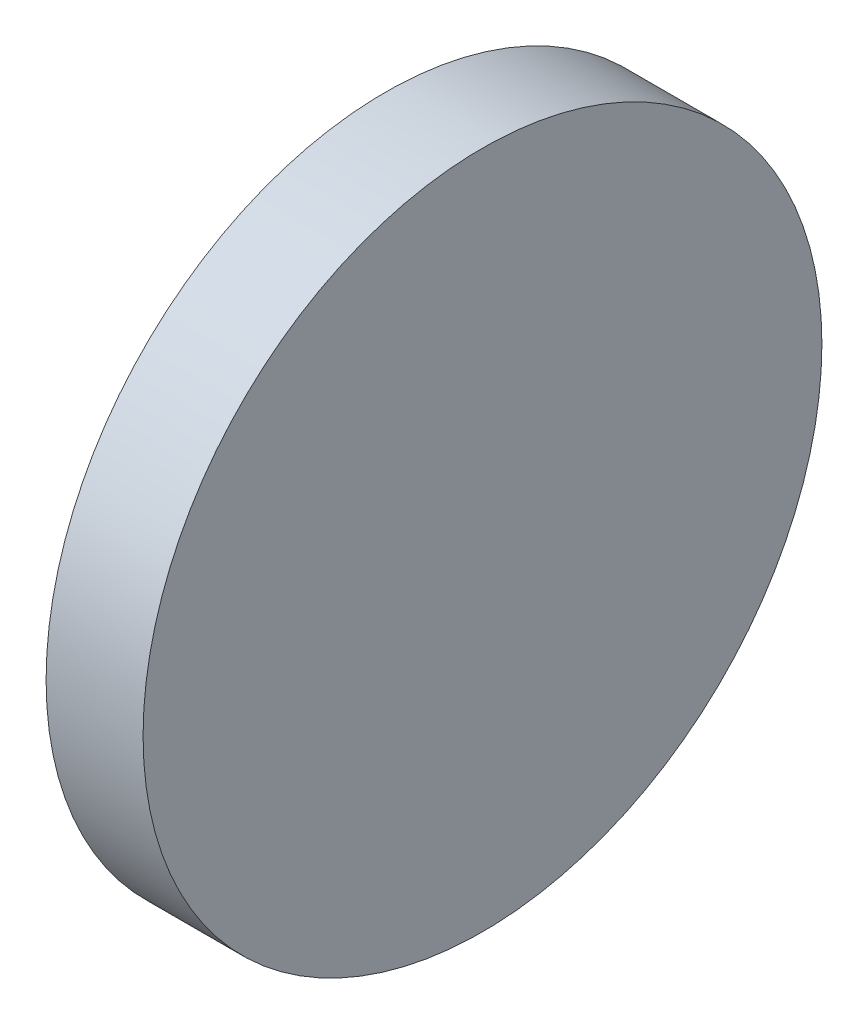
from build123d import *

# Parameters (mm, degrees)
SKETCH1_R           = 35
BOSS_EXTRUDE1_DEPTH = 10


with BuildPart() as part:
    # Sketch1 → Boss-Extrude1 (new body)
    with BuildSketch(Plane(origin=(0, 0, 0), x_dir=(0, 0, -1), z_dir=(1, 0, 0))):
        Circle(SKETCH1_R)
    extrude(amount=-BOSS_EXTRUDE1_DEPTH)


solid = part.part
